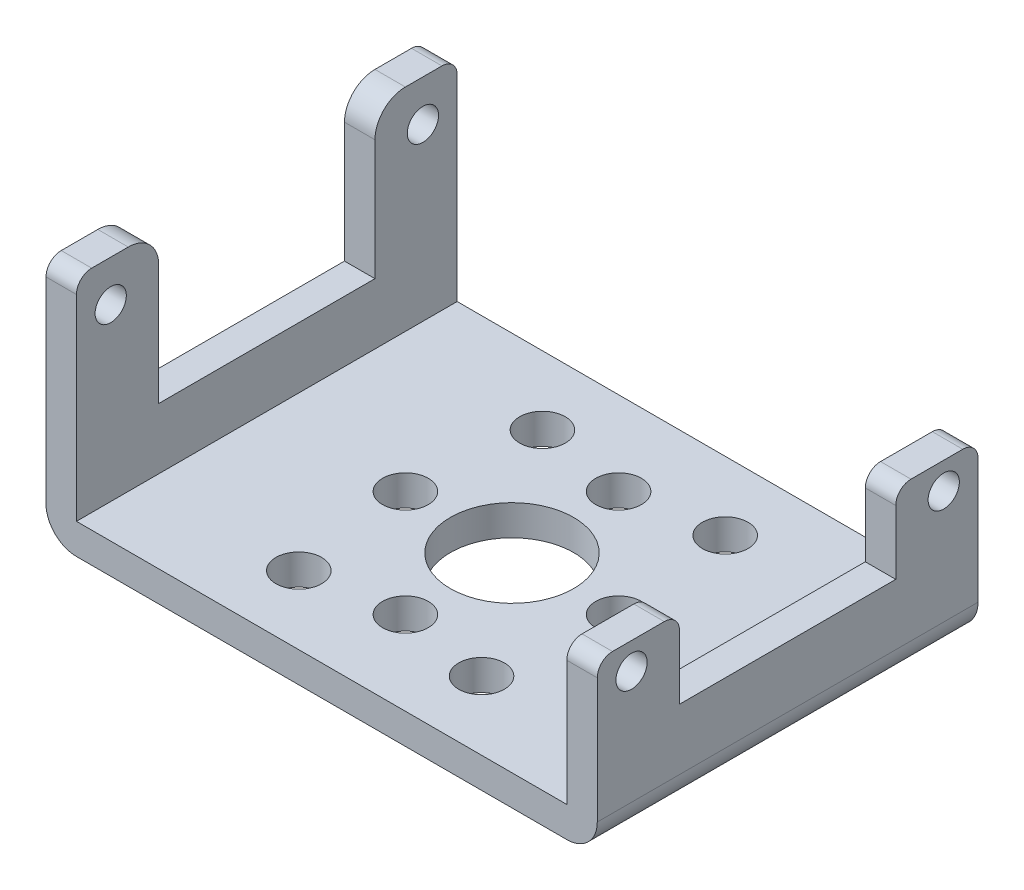
from build123d import *

# Parameters (mm, degrees)
EXTRUDE_1_DEPTH     = 25
SKETCH_2_R          = 1.025
CUT_EXTRUDE_1_DEPTH = 50
FILLET_1_R          = 1
SKETCH_3_R          = 1.025
CUT_EXTRUDE_2_DEPTH = 6
SKETCH_4_R          = 4.05
SKETCH_4_R_2        = 1.5
CUT_EXTRUDE_3_DEPTH = 10


with BuildPart() as part:
    # 草图1 → 凸台-拉伸1 (new body)
    with BuildSketch(Plane.XY):
        with BuildLine():
            Line((2, 0), (34.2, 0))
            ThreePointArc((34.2, 0), (35.614213562, 0.585786438), (36.2, 2))
            Line((36.2, 2), (36.2, 11.2))
            Line((36.2, 11.2), (34.2, 11.2))
            Line((34.2, 11.2), (34.2, 2))
            Line((34.2, 2), (2, 2))
            Line((2, 2), (2, 15.9))
            Line((2, 15.9), (0, 15.9))
            Line((0, 15.9), (0, 2))
            ThreePointArc((0, 2), (0.585786438, 0.585786438), (2, 0))
        make_face()
    extrude(amount=EXTRUDE_1_DEPTH)

    # 草图2 → 切除-拉伸1 (cut)
    with BuildSketch(Plane.ZY):
        with BuildLine():
            Line((0, 15.9), (0, 14.9))
            ThreePointArc((0, 14.9), (0.292893219, 15.607106781), (1, 15.9))
            Line((1, 15.9), (0, 15.9))
        make_face()
        with Locations((2.25, 13.2)):
            Circle(SKETCH_2_R)
        with BuildLine():
            Line((21.6, 15.9), (3.4, 15.9))
            ThreePointArc((3.4, 15.9), (4.814213562, 15.314213562), (5.4, 13.9))
            Line((5.4, 13.9), (5.4, 6))
            Line((5.4, 6), (19.6, 6))
            Line((19.6, 6), (19.6, 13.9))
            ThreePointArc((19.6, 13.9), (20.185786438, 15.314213562), (21.6, 15.9))
        make_face()
        with Locations((22.75, 13.2)):
            Circle(SKETCH_2_R)
        with BuildLine():
            Line((25, 15.9), (24, 15.9))
            ThreePointArc((24, 15.9), (24.707106781, 15.607106781), (25, 14.9))
            Line((25, 14.9), (25, 15.9))
        make_face()
    extrude(amount=-CUT_EXTRUDE_1_DEPTH, mode=Mode.SUBTRACT)

    # 圆角1
    fillet_1_edges = [part.edges().sort_by_distance(p)[0] for p in [
        (35.2, 11.2, 0),
        (35.2, 11.2, 25),
        (35.2, 11.2, 19.6),
        (35.2, 11.2, 5.4),
    ]]
    fillet(fillet_1_edges, radius=FILLET_1_R)

    # 草图3 → 切除-拉伸2 (cut)
    with BuildSketch(Plane(origin=(36.2, 0, 0), x_dir=(0, 0, -1), z_dir=(1, 0, 0))):
        with Locations((-22.75, 9.45)):
            Circle(SKETCH_3_R)
        with Locations((-2.25, 9.45)):
            Circle(SKETCH_3_R)
    extrude(amount=-CUT_EXTRUDE_2_DEPTH, mode=Mode.SUBTRACT)

    # 草图4 → 切除-拉伸3 (cut)
    with BuildSketch(Plane(origin=(0, 2, 0), x_dir=(1, 0, 0), z_dir=(0, 1, 0))):
        with Locations(Location((18.1, -12.5, 0), (0, 0, 270))):
            Circle(SKETCH_4_R)
        with Locations(Location((18.1, -5.5, 0), (0, 0, 270))):
            Circle(SKETCH_4_R_2)
        with Locations(Location((25.1, -12.5, 0), (0, 0, 270))):
            Circle(SKETCH_4_R_2)
        with Locations(Location((18.1, -19.5, 0), (0, 0, 270))):
            Circle(SKETCH_4_R_2)
        with Locations(Location((11.1, -12.5, 0), (0, 0, 270))):
            Circle(SKETCH_4_R_2)
        with Locations(Location((12.1, -4.5, 0), (0, 0, 270))):
            Circle(SKETCH_4_R_2)
        with Locations(Location((24.1, -4.5, 0), (0, 0, 270))):
            Circle(SKETCH_4_R_2)
        with Locations(Location((24.1, -20.5, 0), (0, 0, 270))):
            Circle(SKETCH_4_R_2)
        with Locations(Location((12.1, -20.5, 0), (0, 0, 270))):
            Circle(SKETCH_4_R_2)
    extrude(amount=-CUT_EXTRUDE_3_DEPTH, mode=Mode.SUBTRACT)


solid = part.part
